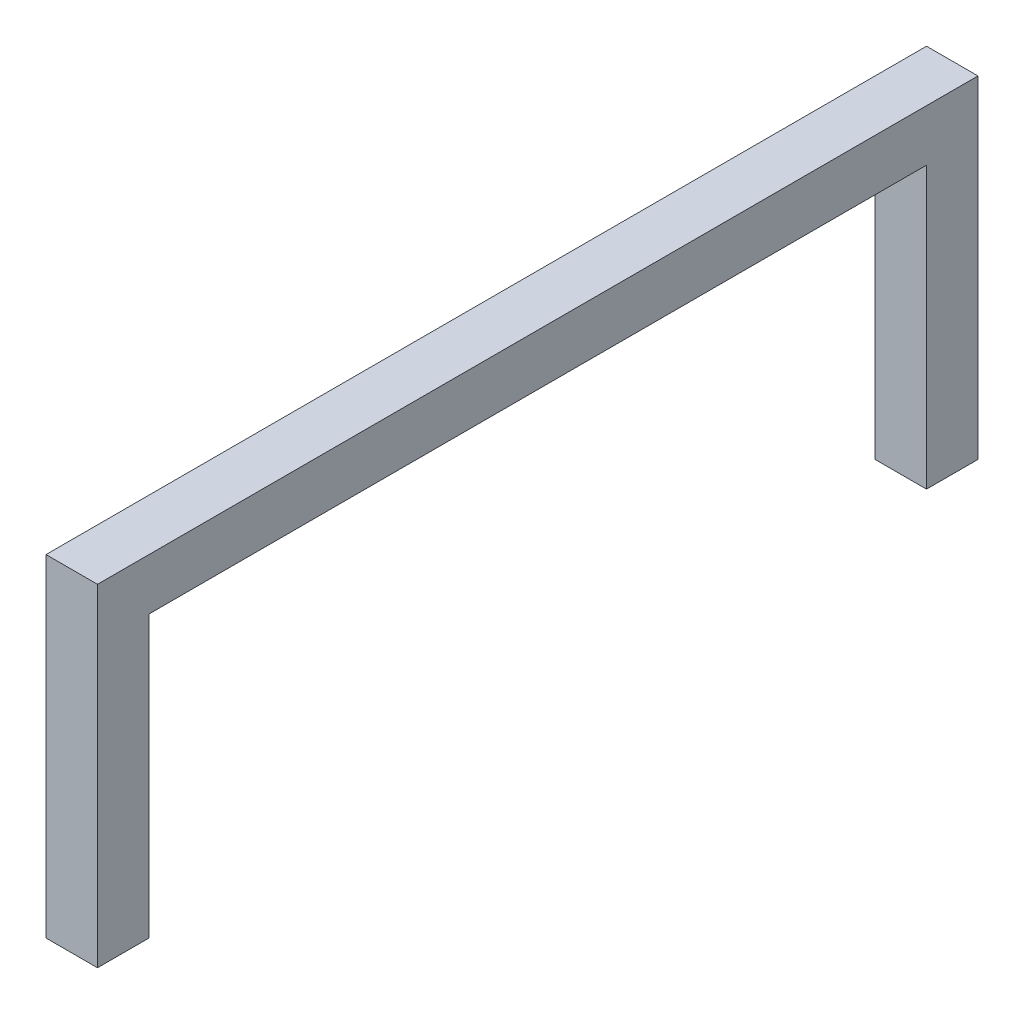
from build123d import *

# Parameters (mm, degrees)
BOSS_EXTRUDE1_DEPTH = 10


with BuildPart() as part:
    # Sketch1 → Boss-Extrude1 (new, symmetric)
    with BuildSketch(Plane(origin=(0, 0, 0), x_dir=(0, 0, -1), z_dir=(1, 0, 0))):
        Polygon((-171, -54.5), (-151, -54.5), (-151, 54.5), (151, 54.5), (151, -54.5), (171, -54.5), (171, 74.5), (0, 74.5), (-171, 74.5), align=None)
    extrude(amount=BOSS_EXTRUDE1_DEPTH, both=True)


solid = part.part
